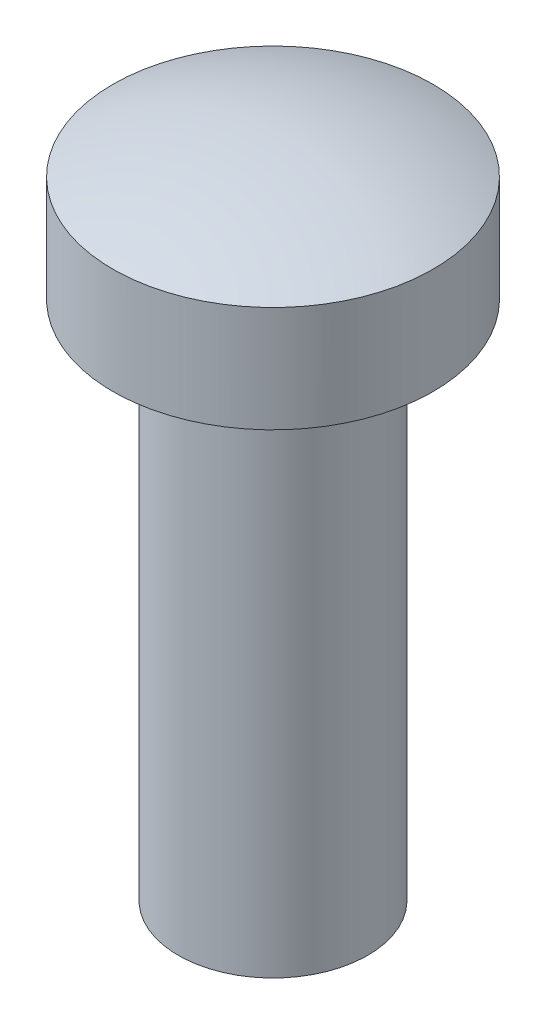
from build123d import *


with BuildPart() as part:
    # 草圖1 → 旋轉1 (revolve)
    with BuildSketch(Plane.XY, mode=Mode.PRIVATE) as revolve_1_sk:
        with BuildLine():
            Line((0, 0), (0, 3.488239362))
            ThreePointArc((0, 3.488239362), (-0.432005419, 3.443019492), (-0.845282603, 3.309320249))
            Line((-0.845282603, 3.309320249), (-0.845282603, 2.75))
            Line((-0.845282603, 2.75), (-0.5, 2.75))
            Line((-0.5, 2.75), (-0.5, 0))
            Line((-0.5, 0), (0, 0))
        make_face()
    revolve(revolve_1_sk.sketch.rotate(Axis((0, 0, 0), (0, 1, 0)), 270), axis=Axis((0, 0, 0), (0, 1, 0)))


solid = part.part
